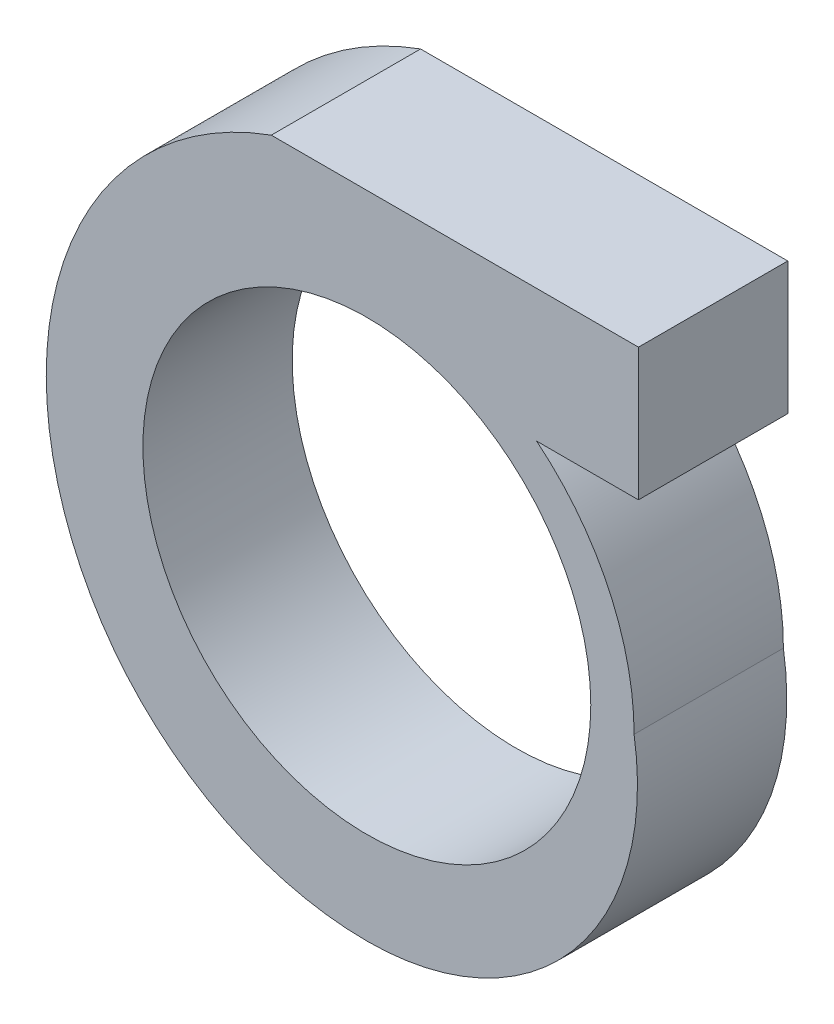
from build123d import *

# Parameters (mm, degrees)
SKETCH1_R           = 70.952762223
SKETCH1_R_2         = 60
BOSS_EXTRUDE1_DEPTH = 20


with BuildPart() as part:
    # Sketch1 → Boss-Extrude1 (new, symmetric)
    # profile 1 of 2: a face of its own
    with BuildSketch(Plane.XY):
        with BuildLine():
            Line((40.505236387, 90.426645724), (-25.752991774, 90.426645724))
            ThreePointArc((-25.752991774, 90.426645724), (-80.41932051, 36.078066751), (-74.051220561, -40.74395377))
            ThreePointArc((-74.051220561, -40.74395377), (-42.820207747, -72.228243513), (0, -83.763687608))
            ThreePointArc((0, -83.763687608), (55.05134178, -58.365548869), (71.457998611, 0))
            ThreePointArc((71.457998611, 0), (-63.58670667, -30.438746727), (45.341543852, 54.990908339))
            Line((45.341543852, 54.990908339), (72.624781189, 54.990908339))
            Line((72.624781189, 54.990908339), (72.624781189, 90.426645724))
            Line((72.624781189, 90.426645724), (40.505236387, 90.426645724))
        make_face()
    # profile 2 of 2: a face of its own
    with BuildSketch(Plane.XY):
        with Locations((0.505236387, 0)):
            Circle(SKETCH1_R)
        with Locations((-0.148485531, 0.959241536)):
            Circle(SKETCH1_R_2, mode=Mode.SUBTRACT)
    extrude(amount=BOSS_EXTRUDE1_DEPTH, both=True)


solid = part.part
